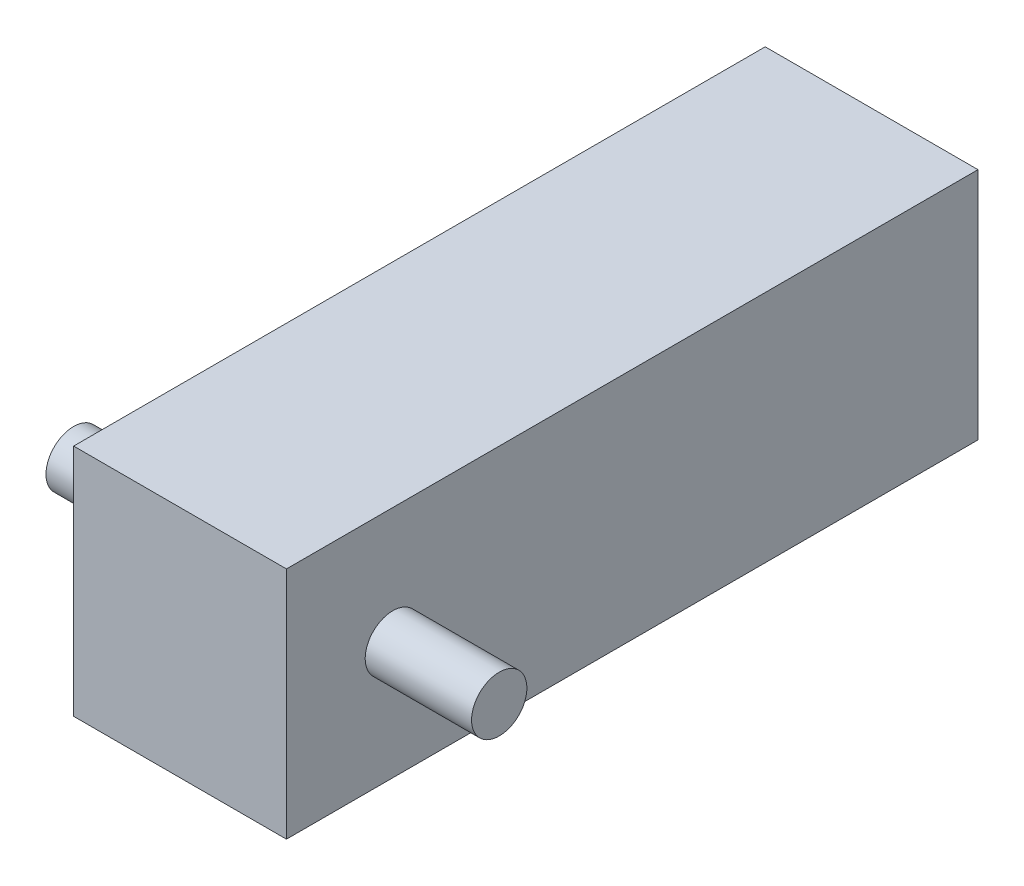
from build123d import *

# Parameters (mm, degrees)
CROQUIS1_W              = 20
CROQUIS1_H              = 65
SALIENTE_EXTRUIR1_DEPTH = 11
CROQUIS3_R              = 2.6
SALIENTE_EXTRUIR2_DEPTH = 20


with BuildPart() as part:
    # Croquis1 → Saliente-Extruir1 (new, symmetric)
    with BuildSketch(Plane(origin=(0, 0, 0), x_dir=(1, 0, 0), z_dir=(0, 1, 0))):
        Rectangle(CROQUIS1_W, CROQUIS1_H)
    extrude(amount=SALIENTE_EXTRUIR1_DEPTH, both=True)

    # Croquis3 → Saliente-Extruir2 (add, symmetric)
    with BuildSketch(Plane.ZY):
        with Locations(Location((22.5, 0, 0), (0, 0, 180))):
            Circle(CROQUIS3_R)
    extrude(amount=SALIENTE_EXTRUIR2_DEPTH, both=True)


solid = part.part
